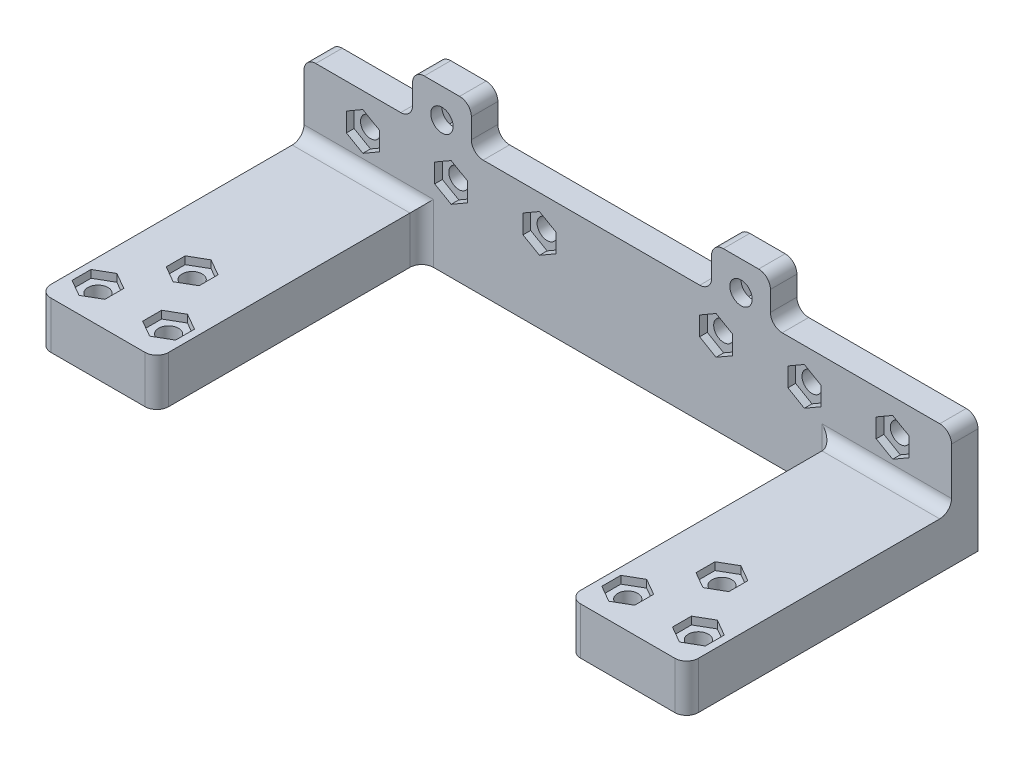
from build123d import *

# Parameters (mm, degrees)
SKETCH_1_W          = 110
SKETCH_1_H          = 20
SKETCH_1_R          = 1.7
EXTRUDE_1_DEPTH     = 4.5
SKETCH_2_W          = 20
SKETCH_2_H          = 8
EXTRUDE_2_DEPTH     = 45
CUT_EXTRUDE_1_DEPTH = 1.3
SKETCH_4_W          = 10
SKETCH_4_H          = 10
EXTRUDE_3_DEPTH     = 4.5
SKETCH_5_R          = 1.9
CUT_EXTRUDE_2_DEPTH = 77.155752448
CUT_EXTRUDE_3_DEPTH = 2.6
SKETCH_7_R          = 1.7
CUT_EXTRUDE_4_DEPTH = 79.898343651
CUT_EXTRUDE_5_DEPTH = 1.3
FILLET_1_R          = 2


with BuildPart() as part:
    # 草图1 → 凸台-拉伸1 (new body)
    with BuildSketch(Plane.XY):
        with Locations((0, 10)):
            Rectangle(SKETCH_1_W, SKETCH_1_H)
        with Locations((-45, 14)):
            Circle(SKETCH_1_R, mode=Mode.SUBTRACT)
        with Locations((-30, 14)):
            Circle(SKETCH_1_R, mode=Mode.SUBTRACT)
        with Locations((-15, 14)):
            Circle(SKETCH_1_R, mode=Mode.SUBTRACT)
        with Locations((15, 14)):
            Circle(SKETCH_1_R, mode=Mode.SUBTRACT)
        with Locations((30, 14)):
            Circle(SKETCH_1_R, mode=Mode.SUBTRACT)
        with Locations((45, 14)):
            Circle(SKETCH_1_R, mode=Mode.SUBTRACT)
    extrude(amount=EXTRUDE_1_DEPTH)

    # 草图2 → 凸台-拉伸2 (add)
    with BuildSketch(Plane.XY.offset(4.5)):
        with Locations((-45, 4)):
            Rectangle(SKETCH_2_W, SKETCH_2_H)
        with Locations((45, 4)):
            Rectangle(SKETCH_2_W, SKETCH_2_H)
    extrude(amount=EXTRUDE_2_DEPTH)

    # 草图3 → 切除-拉伸1 (cut)
    with BuildSketch(Plane.XY.offset(4.5)):
        Polygon((-45, 17.22), (-47.7886018, 15.61), (-47.7886018, 12.39), (-45, 10.78), (-42.2113982, 12.39), (-42.2113982, 15.61), align=None)
        Polygon((-30, 17.22), (-32.7886018, 15.61), (-32.7886018, 12.39), (-30, 10.78), (-27.2113982, 12.39), (-27.2113982, 15.61), align=None)
        Polygon((-15, 17.22), (-17.7886018, 15.61), (-17.7886018, 12.39), (-15, 10.78), (-12.2113982, 12.39), (-12.2113982, 15.61), align=None)
        Polygon((15, 17.22), (12.2113982, 15.61), (12.2113982, 12.39), (15, 10.78), (17.7886018, 12.39), (17.7886018, 15.61), align=None)
        Polygon((30, 17.22), (27.2113982, 15.61), (27.2113982, 12.39), (30, 10.78), (32.7886018, 12.39), (32.7886018, 15.61), align=None)
        Polygon((45, 17.22), (42.2113982, 15.61), (42.2113982, 12.39), (45, 10.78), (47.7886018, 12.39), (47.7886018, 15.61), align=None)
    extrude(amount=-CUT_EXTRUDE_1_DEPTH, mode=Mode.SUBTRACT)

    # 草图4 → 凸台-拉伸3 (add)
    with BuildSketch(Plane.XY.offset(4.5)):
        with Locations((19.238259457, 22.3806251)):
            Rectangle(SKETCH_4_W, SKETCH_4_H)
        with Locations((-31.561740543, 22.3806251)):
            Rectangle(SKETCH_4_W, SKETCH_4_H)
    extrude(amount=-EXTRUDE_3_DEPTH)

    # 草图5 → 切除-拉伸2 (cut, through all)
    with BuildSketch(Plane.XY.offset(4.5)):
        with Locations((19.238259457, 22.3806251)):
            Circle(SKETCH_5_R)
        with Locations((-31.561740543, 22.3806251)):
            Circle(SKETCH_5_R)
    extrude(amount=-CUT_EXTRUDE_2_DEPTH, mode=Mode.SUBTRACT)

    # 草图6 → 切除-拉伸3 (cut)
    with BuildSketch(Plane(origin=(0, 0, 0), x_dir=(-1, 0, 0), z_dir=(0, 0, -1))):
        Polygon((34.861740543, 22.3806251), (33.211740543, 25.238508932), (29.911740543, 25.238508932), (28.261740543, 22.3806251), (29.911740543, 19.522741267), (33.211740543, 19.522741267), align=None)
        Polygon((-15.938259457, 22.3806251), (-17.588259457, 25.238508932), (-20.888259457, 25.238508932), (-22.538259457, 22.3806251), (-20.888259457, 19.522741267), (-17.588259457, 19.522741267), align=None)
    extrude(amount=-CUT_EXTRUDE_3_DEPTH, mode=Mode.SUBTRACT)

    # 草图7 → 切除-拉伸4 (cut, through all)
    with BuildSketch(Plane.XZ):
        with Locations(Location((-51, 43.5, 0), (0, 0, 270))):
            Circle(SKETCH_7_R)
        with Locations(Location((-39, 43.5, 0), (0, 0, 270))):
            Circle(SKETCH_7_R)
        with Locations(Location((-45, 33.5, 0), (0, 0, 270))):
            Circle(SKETCH_7_R)
        with Locations(Location((39, 43.5, 0), (0, 0, 270))):
            Circle(SKETCH_7_R)
        with Locations(Location((51, 43.5, 0), (0, 0, 270))):
            Circle(SKETCH_7_R)
        with Locations(Location((45, 33.5, 0), (0, 0, 270))):
            Circle(SKETCH_7_R)
    extrude(amount=-CUT_EXTRUDE_4_DEPTH, mode=Mode.SUBTRACT)

    # 草图8 → 切除-拉伸5 (cut)
    with BuildSketch(Plane(origin=(0, 8, 0), x_dir=(1, 0, 0), z_dir=(0, 1, 0))):
        Polygon((51, -46.72), (53.7886018, -45.11), (53.7886018, -41.89), (51, -40.28), (48.2113982, -41.89), (48.2113982, -45.11), align=None)
        Polygon((39, -46.72), (41.7886018, -45.11), (41.7886018, -41.89), (39, -40.28), (36.2113982, -41.89), (36.2113982, -45.11), align=None)
        Polygon((45, -36.72), (47.7886018, -35.11), (47.7886018, -31.89), (45, -30.28), (42.2113982, -31.89), (42.2113982, -35.11), align=None)
        Polygon((-39, -46.72), (-36.2113982, -45.11), (-36.2113982, -41.89), (-39, -40.28), (-41.7886018, -41.89), (-41.7886018, -45.11), align=None)
        Polygon((-51, -46.72), (-48.2113982, -45.11), (-48.2113982, -41.89), (-51, -40.28), (-53.7886018, -41.89), (-53.7886018, -45.11), align=None)
        Polygon((-45, -36.72), (-42.2113982, -35.11), (-42.2113982, -31.89), (-45, -30.28), (-47.7886018, -31.89), (-47.7886018, -35.11), align=None)
    extrude(amount=-CUT_EXTRUDE_5_DEPTH, mode=Mode.SUBTRACT)

    # 圆角1
    fillet_1_edges = [part.edges().sort_by_distance(p)[0] for p in [
        (24.238259457, 20, 2.25),
        (14.238259457, 20, 2.25),
        (24.238259457, 27.3806251, 2.25),
        (14.238259457, 27.3806251, 2.25),
        (-26.561740543, 27.3806251, 2.25),
        (-36.561740543, 20, 2.25),
        (-36.561740543, 27.3806251, 2.25),
        (-26.561740543, 20, 2.25),
        (-35, 4, 4.5),
        (-45, 8, 4.5),
        (-55, 4, 49.5),
        (-35, 4, 49.5),
        (45, 8, 4.5),
        (35, 4, 4.5),
        (55, 4, 49.5),
        (35, 4, 49.5),
        (-55, 20, 2.25),
        (55, 20, 2.25),
    ]]
    fillet(fillet_1_edges, radius=FILLET_1_R)


solid = part.part
